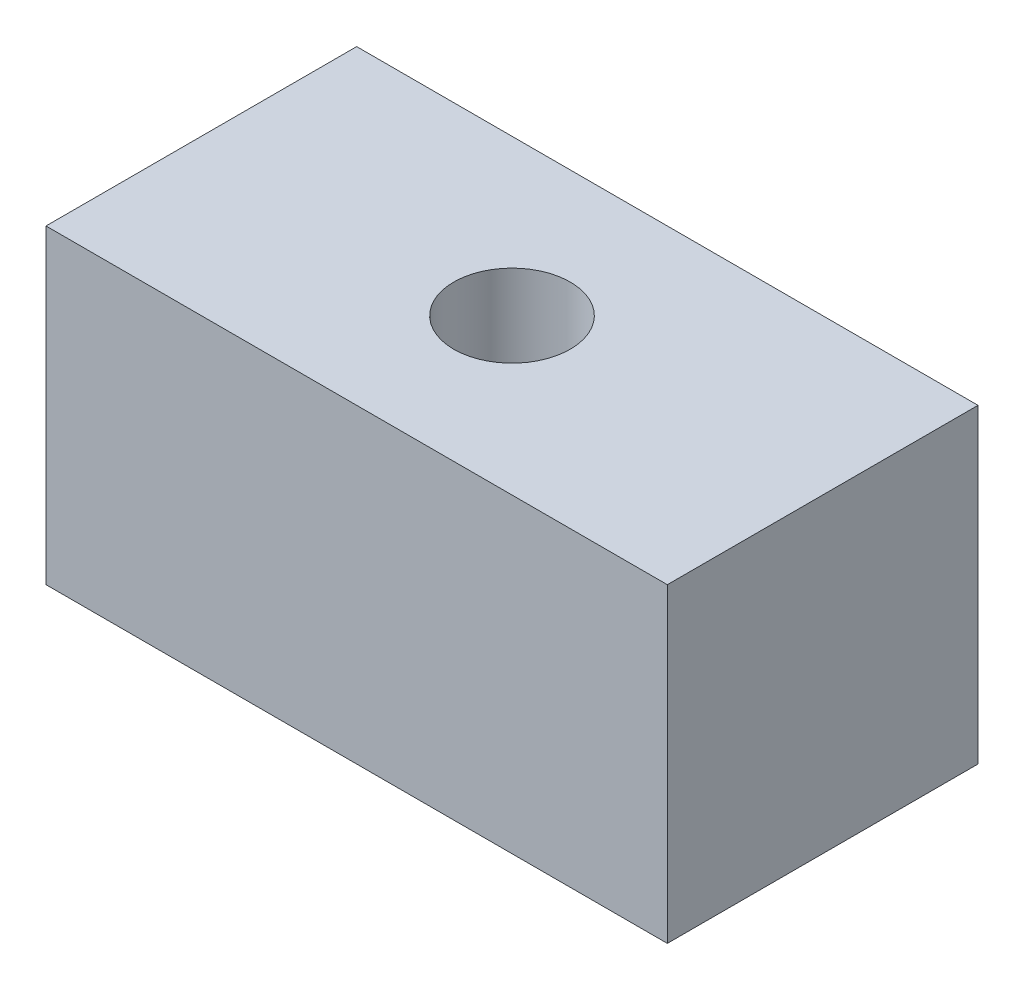
from build123d import *

# Parameters (mm, degrees)
SKETCH3_W           = 101.6
SKETCH3_H           = 50.8
BOSS_EXTRUDE1_DEPTH = 50.8
SKETCH4_R           = 9.525
CUT_EXTRUDE1_DEPTH  = 125.434078933


with BuildPart() as part:
    # Sketch3 → Boss-Extrude1 (new body)
    with BuildSketch(Plane.XY):
        with Locations((50.8, 25.4)):
            Rectangle(SKETCH3_W, SKETCH3_H)
    extrude(amount=BOSS_EXTRUDE1_DEPTH)

    # Sketch4 → Cut-Extrude1 (cut, through all)
    with BuildSketch(Plane(origin=(0, 50.8, 0), x_dir=(1, 0, 0), z_dir=(0, 1, 0))):
        with Locations(Location((50.8, -25.4, 0), (0, 0, 270))):
            Circle(SKETCH4_R)
    extrude(amount=-CUT_EXTRUDE1_DEPTH, mode=Mode.SUBTRACT)


solid = part.part
